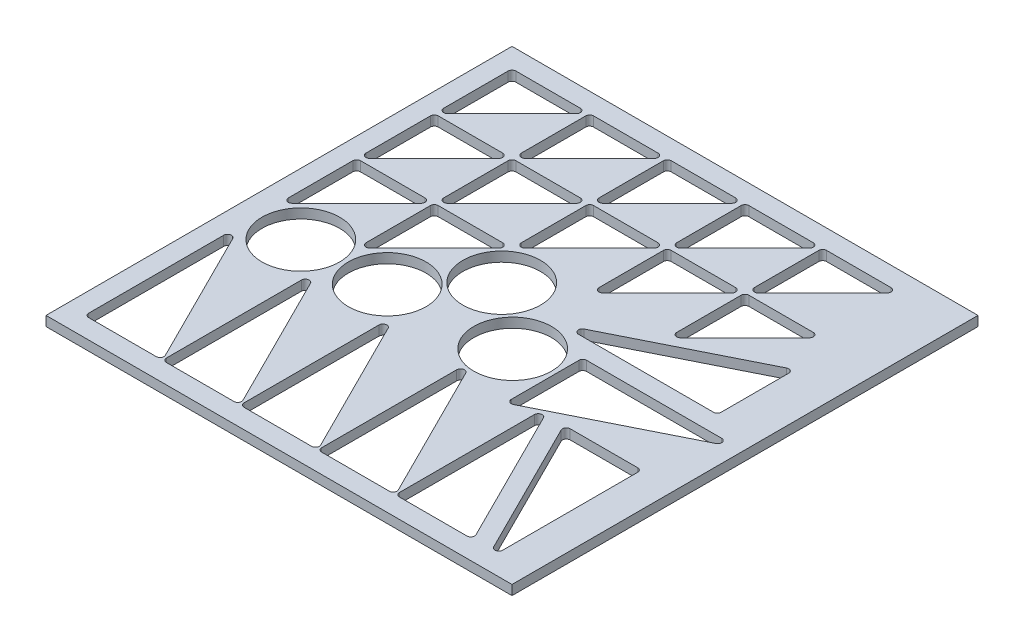
from build123d import *

# Parameters (mm, degrees)
SKETCH1_W           = 304.8
SKETCH1_H           = 304.8
BOSS_EXTRUDE1_DEPTH = 6.35
SKETCH2_R           = 25.4
CUT_EXTRUDE2_DEPTH  = 432.099063441


with BuildPart() as part:
    # Sketch1 → Boss-Extrude1 (new body)
    with BuildSketch(Plane(origin=(0, 0, 0), x_dir=(1, 0, 0), z_dir=(0, 1, 0))):
        with Locations((152.4, 152.4)):
            Rectangle(SKETCH1_W, SKETCH1_H)
    extrude(amount=BOSS_EXTRUDE1_DEPTH)

    # Sketch2 → Cut-Extrude2 (cut, through all)
    with BuildSketch(Plane(origin=(0, 6.35, 0), x_dir=(1, 0, 0), z_dir=(0, 1, 0))):
        with Locations(Location((40.378551944, 126.297217899, 0), (0, 0, 270))):
            Circle(SKETCH2_R)
        with Locations(Location((93.964492013, 129.211934304, 0), (0, 0, 270))):
            Circle(SKETCH2_R)
        with Locations(Location((130.510551558, 167.551665483, 0), (0, 0, 270))):
            Circle(SKETCH2_R)
        with Locations(Location((171.52597858, 133.696113389, 0), (0, 0, 270))):
            Circle(SKETCH2_R)
        with BuildLine():
            Line((12.7, 289.56), (12.7, 247.432102448))
            ThreePointArc((12.7, 247.432102448), (14.267984082, 245.085448436), (17.036051224, 245.636051224))
            Line((17.036051224, 245.636051224), (59.163948776, 287.763948776))
            ThreePointArc((59.163948776, 287.763948776), (59.714551564, 290.532015918), (57.367897552, 292.1))
            Line((57.367897552, 292.1), (15.24, 292.1))
            ThreePointArc((15.24, 292.1), (13.443948776, 291.356051224), (12.7, 289.56))
        make_face()
        with BuildLine():
            Line((67.836051224, 245.636051224), (109.963948776, 287.763948776))
            ThreePointArc((109.963948776, 287.763948776), (110.514551564, 290.532015918), (108.167897552, 292.1))
            Line((108.167897552, 292.1), (66.04, 292.1))
            ThreePointArc((66.04, 292.1), (64.243948776, 291.356051224), (63.5, 289.56))
            Line((63.5, 289.56), (63.5, 247.432102448))
            ThreePointArc((63.5, 247.432102448), (65.067984082, 245.085448436), (67.836051224, 245.636051224))
        make_face()
        with BuildLine():
            Line((118.636051224, 245.636051224), (160.763948776, 287.763948776))
            ThreePointArc((160.763948776, 287.763948776), (161.314551564, 290.532015918), (158.967897552, 292.1))
            Line((158.967897552, 292.1), (116.84, 292.1))
            ThreePointArc((116.84, 292.1), (115.043948776, 291.356051224), (114.3, 289.56))
            Line((114.3, 289.56), (114.3, 247.432102448))
            ThreePointArc((114.3, 247.432102448), (115.867984082, 245.085448436), (118.636051224, 245.636051224))
        make_face()
        with BuildLine():
            Line((169.436051224, 245.636051224), (211.563948776, 287.763948776))
            ThreePointArc((211.563948776, 287.763948776), (212.114551564, 290.532015918), (209.767897552, 292.1))
            Line((209.767897552, 292.1), (167.64, 292.1))
            ThreePointArc((167.64, 292.1), (165.843948776, 291.356051224), (165.1, 289.56))
            Line((165.1, 289.56), (165.1, 247.432102448))
            ThreePointArc((165.1, 247.432102448), (166.667984082, 245.085448436), (169.436051224, 245.636051224))
        make_face()
        with BuildLine():
            Line((220.236051224, 245.636051224), (262.363948776, 287.763948776))
            ThreePointArc((262.363948776, 287.763948776), (262.914551564, 290.532015918), (260.567897552, 292.1))
            Line((260.567897552, 292.1), (218.44, 292.1))
            ThreePointArc((218.44, 292.1), (216.643948776, 291.356051224), (215.9, 289.56))
            Line((215.9, 289.56), (215.9, 247.432102448))
            ThreePointArc((215.9, 247.432102448), (217.467984082, 245.085448436), (220.236051224, 245.636051224))
        make_face()
        with BuildLine():
            Line((67.836051224, 194.836051224), (109.963948776, 236.963948776))
            ThreePointArc((109.963948776, 236.963948776), (110.514551564, 239.732015918), (108.167897552, 241.3))
            Line((108.167897552, 241.3), (66.04, 241.3))
            ThreePointArc((66.04, 241.3), (64.243948776, 240.556051224), (63.5, 238.76))
            Line((63.5, 238.76), (63.5, 196.632102448))
            ThreePointArc((63.5, 196.632102448), (65.067984082, 194.285448436), (67.836051224, 194.836051224))
        make_face()
        with BuildLine():
            Line((118.636051224, 194.836051224), (160.763948776, 236.963948776))
            ThreePointArc((160.763948776, 236.963948776), (161.314551564, 239.732015918), (158.967897552, 241.3))
            Line((158.967897552, 241.3), (116.84, 241.3))
            ThreePointArc((116.84, 241.3), (115.043948776, 240.556051224), (114.3, 238.76))
            Line((114.3, 238.76), (114.3, 196.632102448))
            ThreePointArc((114.3, 196.632102448), (115.867984082, 194.285448436), (118.636051224, 194.836051224))
        make_face()
        with BuildLine():
            Line((169.436051224, 194.836051224), (211.563948776, 236.963948776))
            ThreePointArc((211.563948776, 236.963948776), (212.114551564, 239.732015918), (209.767897552, 241.3))
            Line((209.767897552, 241.3), (167.64, 241.3))
            ThreePointArc((167.64, 241.3), (165.843948776, 240.556051224), (165.1, 238.76))
            Line((165.1, 238.76), (165.1, 196.632102448))
            ThreePointArc((165.1, 196.632102448), (166.667984082, 194.285448436), (169.436051224, 194.836051224))
        make_face()
        with BuildLine():
            Line((220.236051224, 194.836051224), (262.363948776, 236.963948776))
            ThreePointArc((262.363948776, 236.963948776), (262.914551564, 239.732015918), (260.567897552, 241.3))
            Line((260.567897552, 241.3), (218.44, 241.3))
            ThreePointArc((218.44, 241.3), (216.643948776, 240.556051224), (215.9, 238.76))
            Line((215.9, 238.76), (215.9, 196.632102448))
            ThreePointArc((215.9, 196.632102448), (217.467984082, 194.285448436), (220.236051224, 194.836051224))
        make_face()
        with BuildLine():
            Line((17.036051224, 194.836051224), (59.163948776, 236.963948776))
            ThreePointArc((59.163948776, 236.963948776), (59.714551564, 239.732015918), (57.367897552, 241.3))
            Line((57.367897552, 241.3), (15.24, 241.3))
            ThreePointArc((15.24, 241.3), (13.443948776, 240.556051224), (12.7, 238.76))
            Line((12.7, 238.76), (12.7, 196.632102448))
            ThreePointArc((12.7, 196.632102448), (14.267984082, 194.285448436), (17.036051224, 194.836051224))
        make_face()
        with BuildLine():
            Line((17.036051224, 144.036051224), (59.163948776, 186.163948776))
            ThreePointArc((59.163948776, 186.163948776), (59.714551564, 188.932015918), (57.367897552, 190.5))
            Line((57.367897552, 190.5), (15.24, 190.5))
            ThreePointArc((15.24, 190.5), (13.443948776, 189.756051224), (12.7, 187.96))
            Line((12.7, 187.96), (12.7, 145.832102448))
            ThreePointArc((12.7, 145.832102448), (14.267984082, 143.485448436), (17.036051224, 144.036051224))
        make_face()
        with BuildLine():
            Line((67.836051224, 144.036051224), (109.963948776, 186.163948776))
            ThreePointArc((109.963948776, 186.163948776), (110.514551564, 188.932015918), (108.167897552, 190.5))
            Line((108.167897552, 190.5), (66.04, 190.5))
            ThreePointArc((66.04, 190.5), (64.243948776, 189.756051224), (63.5, 187.96))
            Line((63.5, 187.96), (63.5, 145.832102448))
            ThreePointArc((63.5, 145.832102448), (65.067984082, 143.485448436), (67.836051224, 144.036051224))
        make_face()
        with BuildLine():
            Line((12.7, 15.24), (12.7, 103.540387337))
            ThreePointArc((12.7, 103.540387337), (14.656427582, 106.01243977), (17.511845065, 104.67630987))
            Line((17.511845065, 104.67630987), (61.662038734, 16.375922533))
            ThreePointArc((61.662038734, 16.375922533), (61.550846722, 13.904642975), (59.390193669, 12.7))
            Line((59.390193669, 12.7), (15.24, 12.7))
            ThreePointArc((15.24, 12.7), (13.443948776, 13.443948776), (12.7, 15.24))
        make_face()
        with BuildLine():
            Line((68.311845065, 104.67630987), (112.462038734, 16.375922533))
            ThreePointArc((112.462038734, 16.375922533), (112.350846722, 13.904642975), (110.190193669, 12.7))
            Line((110.190193669, 12.7), (66.04, 12.7))
            ThreePointArc((66.04, 12.7), (64.243948776, 13.443948776), (63.5, 15.24))
            Line((63.5, 15.24), (63.5, 103.540387337))
            ThreePointArc((63.5, 103.540387337), (65.456427582, 106.01243977), (68.311845065, 104.67630987))
        make_face()
        with BuildLine():
            Line((119.111845065, 104.67630987), (163.262038734, 16.375922533))
            ThreePointArc((163.262038734, 16.375922533), (163.150846722, 13.904642975), (160.990193669, 12.7))
            Line((160.990193669, 12.7), (116.84, 12.7))
            ThreePointArc((116.84, 12.7), (115.043948776, 13.443948776), (114.3, 15.24))
            Line((114.3, 15.24), (114.3, 103.540387337))
            ThreePointArc((114.3, 103.540387337), (116.256427582, 106.01243977), (119.111845065, 104.67630987))
        make_face()
        with BuildLine():
            Line((169.911845065, 104.67630987), (214.062038734, 16.375922533))
            ThreePointArc((214.062038734, 16.375922533), (213.950846722, 13.904642975), (211.790193669, 12.7))
            Line((211.790193669, 12.7), (167.64, 12.7))
            ThreePointArc((167.64, 12.7), (165.843948776, 13.443948776), (165.1, 15.24))
            Line((165.1, 15.24), (165.1, 103.540387337))
            ThreePointArc((165.1, 103.540387337), (167.056427582, 106.01243977), (169.911845065, 104.67630987))
        make_face()
        with BuildLine():
            Line((220.711845065, 104.67630987), (264.862038734, 16.375922533))
            ThreePointArc((264.862038734, 16.375922533), (264.750846722, 13.904642975), (262.590193669, 12.7))
            Line((262.590193669, 12.7), (218.44, 12.7))
            ThreePointArc((218.44, 12.7), (216.643948776, 13.443948776), (215.9, 15.24))
            Line((215.9, 15.24), (215.9, 103.540387337))
            ThreePointArc((215.9, 103.540387337), (217.856427582, 106.01243977), (220.711845065, 104.67630987))
        make_face()
        with BuildLine():
            Line((277.552172751, 15.24), (233.401979083, 103.540387337))
            ThreePointArc((233.401979083, 103.540387337), (233.513171095, 106.011666895), (235.673824148, 107.21630987))
            Line((235.673824148, 107.21630987), (279.824017817, 107.21630987))
            ThreePointArc((279.824017817, 107.21630987), (281.620069041, 106.472361094), (282.364017817, 104.67630987))
            Line((282.364017817, 104.67630987), (282.364017817, 16.375922533))
            ThreePointArc((282.364017817, 16.375922533), (280.407590235, 13.903870099), (277.552172751, 15.24))
        make_face()
        with BuildLine():
            Line((291.693726792, 146.554658473), (203.393339455, 102.404464805))
            ThreePointArc((203.393339455, 102.404464805), (200.922059898, 102.515656817), (199.717416922, 104.67630987))
            Line((199.717416922, 104.67630987), (199.717416922, 148.826503538))
            ThreePointArc((199.717416922, 148.826503538), (200.461365698, 150.622554763), (202.257416922, 151.366503538))
            Line((202.257416922, 151.366503538), (290.55780426, 151.366503538))
            ThreePointArc((290.55780426, 151.366503538), (293.029856693, 149.410075956), (291.693726792, 146.554658473))
        make_face()
        with BuildLine():
            Line((183.6711366, 168.254047869), (271.971523937, 212.404241537))
            ThreePointArc((271.971523937, 212.404241537), (274.442803495, 212.293049525), (275.64744647, 210.132396472))
            Line((275.64744647, 210.132396472), (275.64744647, 165.982202803))
            ThreePointArc((275.64744647, 165.982202803), (274.903497694, 164.186151579), (273.10744647, 163.442202803))
            Line((273.10744647, 163.442202803), (184.807059133, 163.442202803))
            ThreePointArc((184.807059133, 163.442202803), (182.335006699, 165.398630385), (183.6711366, 168.254047869))
        make_face()
    extrude(amount=-CUT_EXTRUDE2_DEPTH, mode=Mode.SUBTRACT)


solid = part.part
